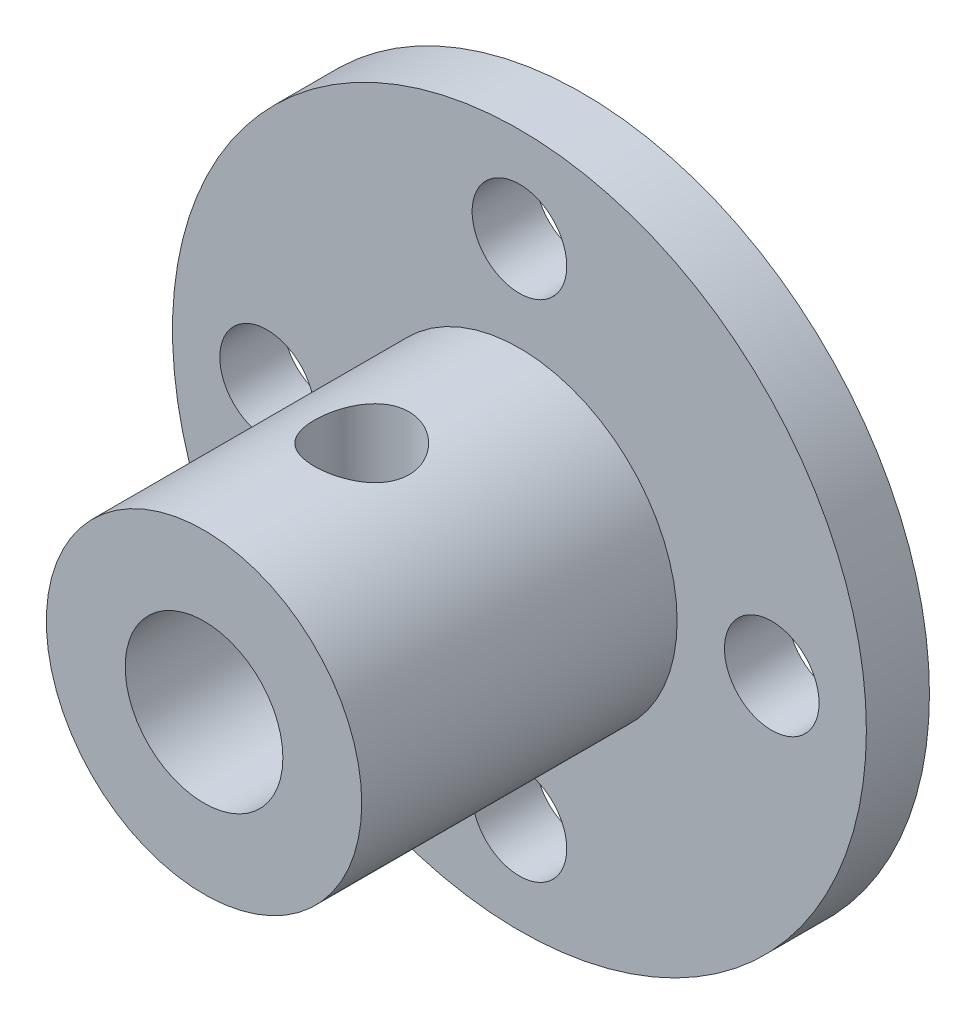
from build123d import *

# Parameters (mm, degrees)
SKETCH_1_R               = 11
SKETCH_1_R_2             = 1.5
SKETCH_1_R_3             = 2.5
EXTRUDE_1_DEPTH          = 2
SKETCH_2_R               = 5
SKETCH_2_R_2             = 2.5
EXTRUDE_2_DEPTH          = 10
CUT_EXTRUDE_1_DEPTH      = 20.646882704
CUT_EXTRUDE_1_DEPTH_BACK = 20.646882704
SKETCH_3_R               = 1.5


with BuildPart() as part:
    # Эскиз1 → Бобышка-Вытянуть1 (new body)
    with BuildSketch(Plane.XY):
        Circle(SKETCH_1_R)
        with Locations((-8, 0)):
            Circle(SKETCH_1_R_2, mode=Mode.SUBTRACT)
        with Locations((0, 8)):
            Circle(SKETCH_1_R_2, mode=Mode.SUBTRACT)
        with Locations((8, 0)):
            Circle(SKETCH_1_R_2, mode=Mode.SUBTRACT)
        with Locations((0, -8)):
            Circle(SKETCH_1_R_2, mode=Mode.SUBTRACT)
        Circle(SKETCH_1_R_3, mode=Mode.SUBTRACT)
    extrude(amount=EXTRUDE_1_DEPTH)

    # Эскиз2 → Бобышка-Вытянуть2 (add)
    with BuildSketch(Plane.XY.offset(2)):
        Circle(SKETCH_2_R)
        Circle(SKETCH_2_R_2, mode=Mode.SUBTRACT)
    extrude(amount=EXTRUDE_2_DEPTH)

    # Эскиз3 → Вырез-Вытянуть1 (cut, two sides: drawn at the far end of the back side and taken through both)
    with BuildSketch(Plane(origin=(0, 0, 0), x_dir=(1, 0, 0), z_dir=(0, 1, 0)).offset(-CUT_EXTRUDE_1_DEPTH_BACK)):
        with Locations(Location((0, -7, 0), (0, 0, 270))):
            Circle(SKETCH_3_R)
    extrude(amount=CUT_EXTRUDE_1_DEPTH + CUT_EXTRUDE_1_DEPTH_BACK, mode=Mode.SUBTRACT)


solid = part.part
